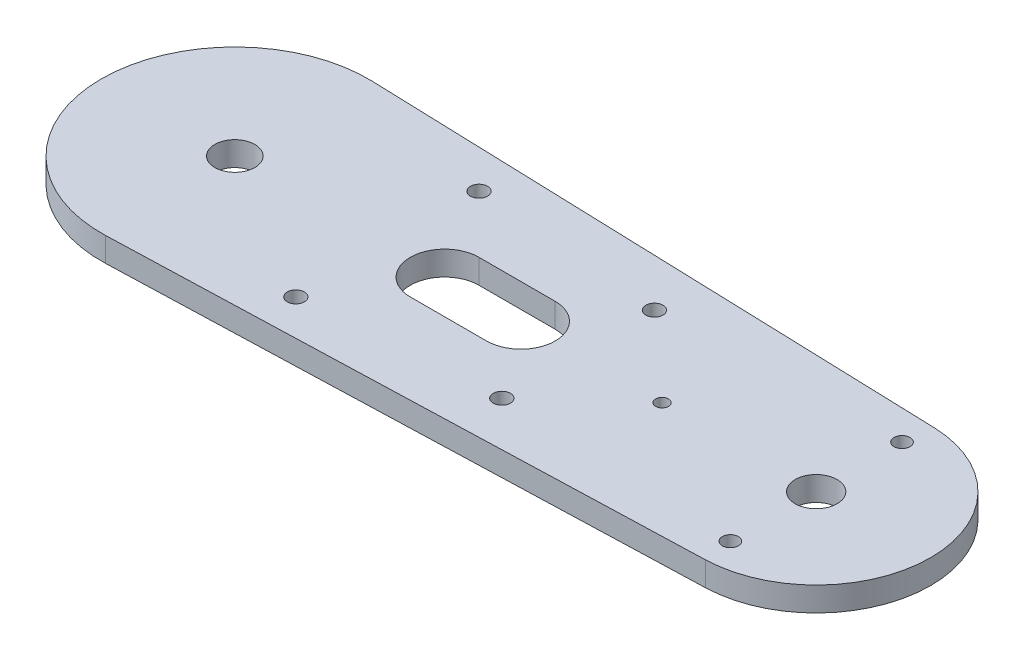
from build123d import *

# Parameters (mm, degrees)
PLACA_START                         = -10.35
PLACA_DEPTH                         = 6.35
PLACA_R1_START                      = -10.35
CROQUIS2_R                          = 35
PLACA_R1_DEPTH                      = 6.35
PLACA_R2_START                      = -10.35
CROQUIS3_R                          = 30
PLACA_R2_DEPTH                      = 6.35
ALIGERADO_START                     = -10.35
ALIGERADO_DEPTH                     = 6.35
BARRENOS_SEPARADORES_M4_START       = -10.35
CROQUIS5_R                          = 2.25
BARRENOS_SEPARADORES_M4_DEPTH       = 6.35
PASO_PERNOS_Y_ROSCA_M5_KFL000_START = -10.35
CROQUIS6_R                          = 5.25
CROQUIS6_R_2                        = 5.5
CROQUIS6_R_3                        = 2.1
PASO_PERNOS_Y_ROSCA_M5_KFL000_DEPTH = 6.35
ROSCA_M3_BASES_CINCHO_START         = -10.35
CROQUIS7_R                          = 1.25
ROSCA_M3_BASES_CINCHO_DEPTH         = 6.35
PASO_M3_BASES_CINCHO_START          = -10.35
CROQUIS8_R                          = 1.7
PASO_M3_BASES_CINCHO_DEPTH          = 6.35


with BuildPart() as part:
    # Croquis1 → Placa (new body)
    with BuildSketch(Plane(origin=(0, 0, 0), x_dir=(1, 0, 0), z_dir=(0, 1, 0)).offset(PLACA_START)):
        Polygon((1.148293963, -206.431158085), (153.384251969, -201.433849787), (153.384251969, -141.466150213), (1.148293963, -136.468841915), align=None)
    extrude(amount=PLACA_DEPTH)

    # Croquis2 → Placa_r1 (add)
    with BuildSketch(Plane(origin=(0, 0, 0), x_dir=(1, 0, 0), z_dir=(0, 1, 0)).offset(PLACA_R1_START)):
        with Locations((0, -171.45)):
            Circle(CROQUIS2_R)
    extrude(amount=PLACA_R1_DEPTH)

    # Croquis3 → Placa_r2 (add)
    with BuildSketch(Plane(origin=(0, 0, 0), x_dir=(1, 0, 0), z_dir=(0, 1, 0)).offset(PLACA_R2_START)):
        with Locations((152.4, -171.45)):
            Circle(CROQUIS3_R)
    extrude(amount=PLACA_R2_DEPTH)

    # Croquis4 → Aligerado (cut)
    with BuildSketch(Plane(origin=(0, 0, 0), x_dir=(1, 0, 0), z_dir=(0, 1, 0)).offset(ALIGERADO_START)):
        with BuildLine():
            Line((55, -162.45), (75, -162.45))
            ThreePointArc((75, -162.45), (84, -171.45), (75, -180.45))
            Line((75, -180.45), (55, -180.45))
            ThreePointArc((55, -180.45), (46, -171.45), (55, -162.45))
        make_face()
    extrude(amount=ALIGERADO_DEPTH, mode=Mode.SUBTRACT)

    # Croquis5 → Barrenos_separadores_M4 (cut)
    with BuildSketch(Plane(origin=(0, 0, 0), x_dir=(1, 0, 0), z_dir=(0, 1, 0)).offset(BARRENOS_SEPARADORES_M4_START)):
        with Locations(Location((40, -195.45, 0), (0, 0, 270))):
            Circle(CROQUIS5_R)
        with Locations(Location((40, -147.45, 0), (0, 0, 270))):
            Circle(CROQUIS5_R)
        with Locations(Location((90, -191.45, 0), (0, 0, 270))):
            Circle(CROQUIS5_R)
        with Locations(Location((90, -151.45, 0), (0, 0, 270))):
            Circle(CROQUIS5_R)
    extrude(amount=BARRENOS_SEPARADORES_M4_DEPTH, mode=Mode.SUBTRACT)

    # Croquis6 → Paso_pernos_y_rosca_M5_KFL000 (cut)
    with BuildSketch(Plane(origin=(0, 0, 0), x_dir=(1, 0, 0), z_dir=(0, 1, 0)).offset(PASO_PERNOS_Y_ROSCA_M5_KFL000_START)):
        with Locations(Location((0, -171.45, 0), (0, 0, 270))):
            Circle(CROQUIS6_R)
        with Locations(Location((152.4, -171.45, 0), (0, 0, 270))):
            Circle(CROQUIS6_R_2)
        with Locations(Location((152.4, -193.95, 0), (0, 0, 270))):
            Circle(CROQUIS6_R_3)
        with Locations(Location((152.4, -148.95, 0), (0, 0, 270))):
            Circle(CROQUIS6_R_3)
    extrude(amount=PASO_PERNOS_Y_ROSCA_M5_KFL000_DEPTH, mode=Mode.SUBTRACT)

    # Croquis7 → Rosca_M3_bases_cincho (cut)
    with BuildSketch(Plane(origin=(0, 0, 0), x_dir=(1, 0, 0), z_dir=(0, 1, 0)).offset(ROSCA_M3_BASES_CINCHO_START)):
        with Locations(Location((112, -171.45, 0), (0, 0, 270))):
            Circle(CROQUIS7_R)
    extrude(amount=ROSCA_M3_BASES_CINCHO_DEPTH, mode=Mode.SUBTRACT)

    # Croquis8 → Paso_M3_bases_cincho (cut)
    with BuildSketch(Plane(origin=(0, 0, 0), x_dir=(1, 0, 0), z_dir=(0, 1, 0)).offset(PASO_M3_BASES_CINCHO_START)):
        with Locations(Location((112, -171.45, 0), (0, 0, 270))):
            Circle(CROQUIS8_R)
    extrude(amount=PASO_M3_BASES_CINCHO_DEPTH, mode=Mode.SUBTRACT)


solid = part.part
